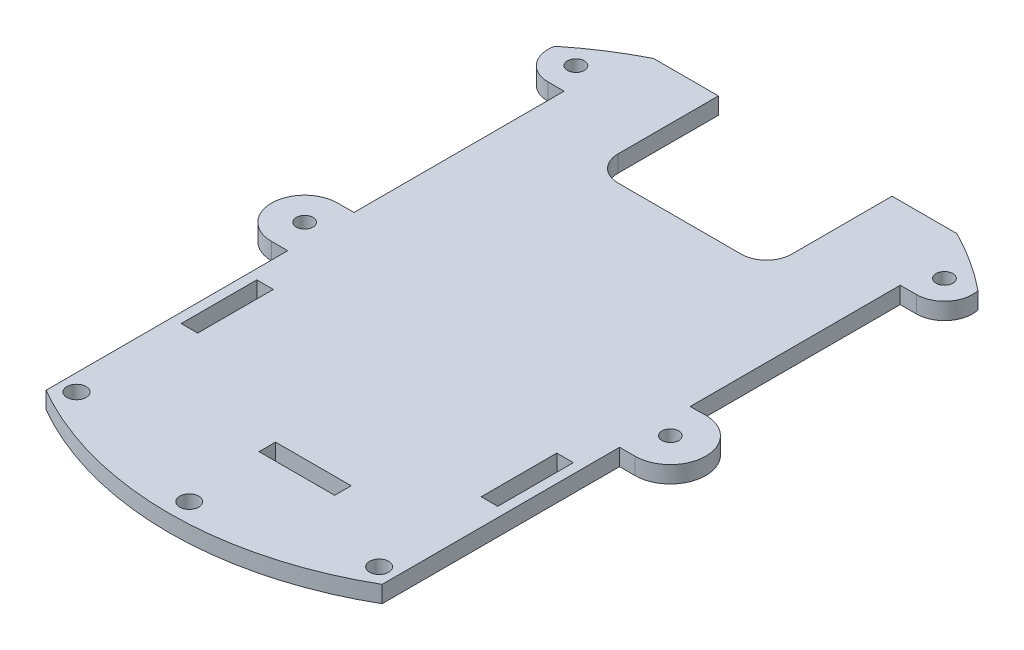
from build123d import *

# Parameters (mm, degrees)
CROQUIS1_R                   = 1.5
CROQUIS1_W                   = 2.95
CROQUIS1_H                   = 13.5
CROQUIS1_W_2                 = 13.5
CROQUIS1_H_2                 = 2.95
SALIENTE_EXTRUIR1_DEPTH      = 3
TALADRO_DE_MARGEN_PARA_M31_D = 3.4


with BuildPart() as part:
    # Croquis1 → Saliente-Extruir1 (new body)
    with BuildSketch(Plane(origin=(0, 0, 0), x_dir=(1, 0, 0), z_dir=(0, 1, 0))):
        with BuildLine():
            Line((-30, -38.4717102), (-30, 4.669623367))
            Line((-30, 4.669623367), (-32.892040435, 4.669623367))
            ThreePointArc((-32.892040435, 4.669623367), (-38.806634145, 10.584217077), (-32.892040435, 16.498810786))
            Line((-32.892040435, 16.498810786), (-30, 16.498810786))
            Line((-30, 16.498810786), (-30, 45))
            Line((-30, 45), (-30, 54))
            Line((-30, 54), (-32.892040435, 54))
            ThreePointArc((-32.892040435, 54), (-36.801169554, 55.882515512), (-37.766700191, 60.112516186))
            ThreePointArc((-37.766700191, 60.112516186), (-32.601856319, 63.859635989), (-27.068280751, 67.037065844))
            Line((-27.068280751, 67.037065844), (-15.492425724, 67.037065844))
            Line((-15.492425724, 67.037065844), (-15.492425724, 55.619045247))
            Line((-15.492425724, 55.619045247), (-15.492425724, 49.113101928))
            ThreePointArc((-15.492425724, 49.113101928), (-14.174406239, 45.931121412), (-10.992425724, 44.613101928))
            Line((-10.992425724, 44.613101928), (11.007574276, 44.613101928))
            ThreePointArc((11.007574276, 44.613101928), (14.189554792, 45.931121412), (15.507574276, 49.113101928))
            Line((15.507574276, 49.113101928), (15.507574276, 55.631560476))
            Line((15.507574276, 55.631560476), (15.507574276, 67.037065844))
            Line((15.507574276, 67.037065844), (27.068280751, 67.037065844))
            ThreePointArc((27.068280751, 67.037065844), (32.60050386, 63.860511342), (37.764196466, 60.114544216))
            ThreePointArc((37.764196466, 60.114544216), (36.799777556, 55.883328786), (32.89, 54))
            Line((32.89, 54), (30, 54))
            Line((30, 54), (30, 45))
            Line((30, 45), (30, 16.498810786))
            Line((30, 16.498810786), (32.75, 16.545073224))
            ThreePointArc((32.75, 16.545073224), (39.071015067, 10.224058157), (32.75, 3.90304309))
            Line((32.75, 3.90304309), (30, 3.90304309))
            Line((30, 3.90304309), (30, -38.4717102))
            ThreePointArc((30, -38.4717102), (0, -46.510185973), (-30, -38.4717102))
        make_face()
        with Locations(Location((-32.892040435, 10.584217077, 0), (0, 0, 270))):
            Circle(CROQUIS1_R, mode=Mode.SUBTRACT)
        with Locations(Location((32.75, 10.224058157, 0), (0, 0, 270))):
            Circle(CROQUIS1_R, mode=Mode.SUBTRACT)
        with Locations(Location((-32.892040435, 59, 0), (0, 0, 270))):
            Circle(CROQUIS1_R, mode=Mode.SUBTRACT)
        with Locations(Location((32.89, 59, 0), (0, 0, 270))):
            Circle(CROQUIS1_R, mode=Mode.SUBTRACT)
        with Locations((-26.775, -9.34695691)):
            Rectangle(CROQUIS1_W, CROQUIS1_H, mode=Mode.SUBTRACT)
        with Locations((26.775, -9.34695691)):
            Rectangle(CROQUIS1_W, CROQUIS1_H, mode=Mode.SUBTRACT)
        with Locations((5.25, -27.475)):
            Rectangle(CROQUIS1_W_2, CROQUIS1_H_2, mode=Mode.SUBTRACT)
    extrude(amount=SALIENTE_EXTRUIR1_DEPTH)

    # Taladro de margen para M31 (through all)
    with Locations(Plane(origin=(-27.009031687, 3, 36.020030417), x_dir=(0, 0, 1), z_dir=(0, 1, 0))):
        with Locations((0, 0), (6.887961272, 27.009031687), (0, 54.018063374)):
            Hole(TALADRO_DE_MARGEN_PARA_M31_D / 2)


solid = part.part
